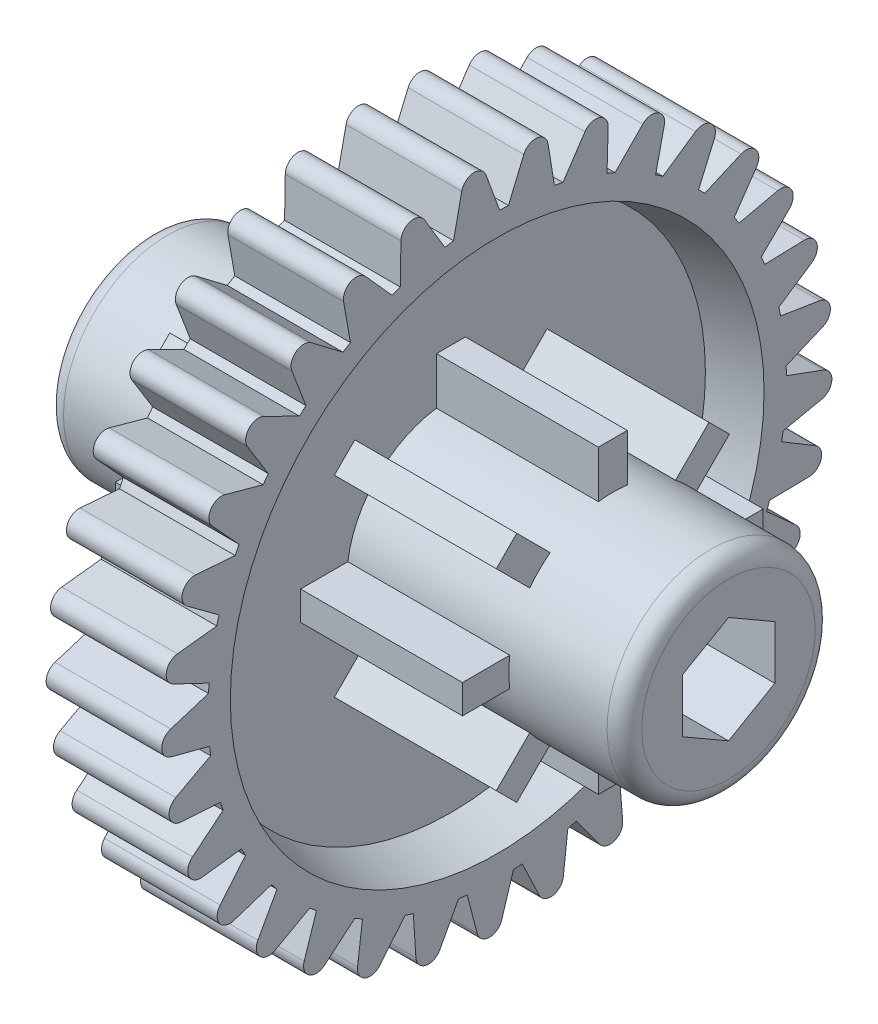
from build123d import *

# Parameters (mm, degrees)
SKETCH1_R           = 4.5
BOSS_EXTRUDE1_DEPTH = 12.5
BOSS_EXTRUDE2_DEPTH = 7.5
SKETCH3_R           = 11
BOSS_EXTRUDE3_DEPTH = 0.5
SKETCH5_R           = 12.5
SKETCH5_R_2         = 11
BOSS_EXTRUDE4_DEPTH = 2.5
DRAFT4_ANGLE        = 15
BOSS_EXTRUDE5_DEPTH = 2.5
FILLET1_R           = 0.75
CUT_EXTRUDE1_DEPTH  = 25.013233318


with BuildPart() as part:
    # Sketch1 → Boss-Extrude1 (new body)
    with BuildSketch(Plane(origin=(0, 0, 0), x_dir=(0, 0, -1), z_dir=(1, 0, 0))):
        Circle(SKETCH1_R)
        Polygon((0, -2.309401077), (2, -1.154700538), (2, 1.154700538), (0, 2.309401077), (-2, 1.154700538), (-2, -1.154700538), align=None, mode=Mode.SUBTRACT)
    extrude(amount=BOSS_EXTRUDE1_DEPTH)

    # Sketch2 → Boss-Extrude2 (add)
    with BuildSketch(Plane(origin=(0, 0, 0), x_dir=(0, 0, -1), z_dir=(1, 0, 0))):
        with BuildLine():
            Line((-0.625, 4.456385867), (-0.625, 6.5))
            Line((-0.625, 6.5), (0.625, 6.5))
            Line((0.625, 6.5), (0.625, 4.456385867))
            ThreePointArc((0.625, 4.456385867), (0, 4.5), (-0.625, 4.456385867))
        make_face()
        with BuildLine():
            Line((2.709198928, 3.593082405), (4.154252339, 5.038135816))
            Line((4.154252339, 5.038135816), (5.038135816, 4.154252339))
            Line((5.038135816, 4.154252339), (3.593082405, 2.709198928))
            ThreePointArc((3.593082405, 2.709198928), (3.181980515, 3.181980515), (2.709198928, 3.593082405))
        make_face()
        with BuildLine():
            Line((4.456385867, 0.625), (6.5, 0.625))
            Line((6.5, 0.625), (6.5, -0.625))
            Line((6.5, -0.625), (4.456385867, -0.625))
            ThreePointArc((4.456385867, -0.625), (4.5, 0), (4.456385867, 0.625))
        make_face()
        with BuildLine():
            Line((3.593082405, -2.709198928), (5.038135816, -4.154252339))
            Line((5.038135816, -4.154252339), (4.154252339, -5.038135816))
            Line((4.154252339, -5.038135816), (2.709198928, -3.593082405))
            ThreePointArc((2.709198928, -3.593082405), (3.181980515, -3.181980515), (3.593082405, -2.709198928))
        make_face()
        with BuildLine():
            Line((0.625, -4.456385867), (0.625, -6.5))
            Line((0.625, -6.5), (-0.625, -6.5))
            Line((-0.625, -6.5), (-0.625, -4.456385867))
            ThreePointArc((-0.625, -4.456385867), (0, -4.5), (0.625, -4.456385867))
        make_face()
        with BuildLine():
            Line((-2.709198928, -3.593082405), (-4.154252339, -5.038135816))
            Line((-4.154252339, -5.038135816), (-5.038135816, -4.154252339))
            Line((-5.038135816, -4.154252339), (-3.593082405, -2.709198928))
            ThreePointArc((-3.593082405, -2.709198928), (-3.181980515, -3.181980515), (-2.709198928, -3.593082405))
        make_face()
        with BuildLine():
            Line((-4.456385867, -0.625), (-6.5, -0.625))
            Line((-6.5, -0.625), (-6.5, 0.625))
            Line((-6.5, 0.625), (-4.456385867, 0.625))
            ThreePointArc((-4.456385867, 0.625), (-4.5, 0), (-4.456385867, -0.625))
        make_face()
        with BuildLine():
            Line((-3.593082405, 2.709198928), (-5.038135816, 4.154252339))
            Line((-5.038135816, 4.154252339), (-4.154252339, 5.038135816))
            Line((-4.154252339, 5.038135816), (-2.709198928, 3.593082405))
            ThreePointArc((-2.709198928, 3.593082405), (-3.181980515, 3.181980515), (-3.593082405, 2.709198928))
        make_face()
    extrude(amount=BOSS_EXTRUDE2_DEPTH)

    # Sketch3 → Boss-Extrude3 (add)
    with BuildSketch(Plane(origin=(0, 0, 0), x_dir=(0, 0, -1), z_dir=(1, 0, 0))):
        Circle(SKETCH3_R)
    extrude(amount=BOSS_EXTRUDE3_DEPTH)

    # Sketch5 → Boss-Extrude4 (add)
    with BuildSketch(Plane(origin=(0, 0, 0), x_dir=(0, 0, -1), z_dir=(1, 0, 0))):
        Circle(SKETCH5_R)
        Circle(SKETCH5_R_2, mode=Mode.SUBTRACT)
    extrude(amount=BOSS_EXTRUDE4_DEPTH)

    # Draft4
    draft4_faces = [part.faces().sort_by_distance(p)[0] for p in [
        (1.5, 0, 11),
    ]]
    draft(draft4_faces, Plane(origin=(0.5, 0, 0), x_dir=(0, 0, 1), z_dir=(1, 0, 0)), DRAFT4_ANGLE)

    # Sketch6 → Boss-Extrude5 (add)
    with BuildSketch(Plane(origin=(0, 0, 0), x_dir=(0, 0, -1), z_dir=(1, 0, 0))):
        with BuildLine():
            Line((-9.758179239, -7.812038015), (-11.38352881, -8.342998719))
            ThreePointArc((-11.38352881, -8.342998719), (-12.0098, -8.128467143), (-11.976202747, -7.467323721))
            Line((-11.976202747, -7.467323721), (-10.879194443, -6.155739457))
            ThreePointArc((-10.879194443, -6.155739457), (-10.351865984, -7.006345028), (-9.758179239, -7.812038015))
        make_face()
        with BuildLine():
            Line((-8.103398312, -9.517611875), (-9.598890726, -10.346576856))
            ThreePointArc((-9.598890726, -10.346576856), (-10.254444746, -10.254444746), (-10.346576856, -9.598890726))
            Line((-10.346576856, -9.598890726), (-9.517611875, -8.103398312))
            ThreePointArc((-9.517611875, -8.103398312), (-8.838834765, -8.838834765), (-8.103398312, -9.517611875))
        make_face()
        with BuildLine():
            Line((-11.060274143, -5.824116747), (-12.756736504, -6.037882871))
            ThreePointArc((-12.756736504, -6.037882871), (-13.331089789, -5.708705558), (-13.172977468, -5.06586818))
            Line((-13.172977468, -5.06586818), (-11.847574579, -3.98559614))
            ThreePointArc((-11.847574579, -3.98559614), (-11.490753795, -4.920627727), (-11.060274143, -5.824116747))
        make_face()
        with BuildLine():
            Line((-11.962621922, -3.625696726), (-13.668882503, -3.514542204))
            ThreePointArc((-13.668882503, -3.514542204), (-14.17055926, -3.08261648), (-13.893646461, -2.481318965))
            Line((-13.893646461, -2.481318965), (-12.387752501, -1.671402994))
            ThreePointArc((-12.387752501, -1.671402994), (-12.214335825, -2.657066119), (-11.962621922, -3.625696726))
        make_face()
        with BuildLine():
            Line((-12.432609377, -1.296234578), (-14.086999475, -0.864176825))
            ThreePointArc((-14.086999475, -0.864176825), (-14.497867799, -0.345113611), (-14.112162872, 0.192911583))
            Line((-14.112162872, 0.192911583), (-12.480204772, 0.703199011))
            ThreePointArc((-12.480204772, 0.703199011), (-12.496459934, -0.297471219), (-12.432609377, -1.296234578))
        make_face()
        with BuildLine():
            Line((-12.453249936, 1.080076865), (-13.995975582, 1.817422156))
            ThreePointArc((-13.995975582, 1.817422156), (-14.301185621, 2.404862563), (-13.820628947, 2.860169803))
            Line((-13.820628947, 2.860169803), (-12.121589925, 3.052385572))
            ThreePointArc((-12.121589925, 3.052385572), (-12.326929421, 2.072875066), (-12.453249936, 1.080076865))
        make_face()
        with BuildLine():
            Line((-12.023797596, 3.417351515), (-13.399100666, 4.433334765))
            ThreePointArc((-13.399100666, 4.433334765), (-13.587621334, 5.067920738), (-13.029581483, 5.424054035))
            Line((-13.029581483, 5.424054035), (-11.324869236, 5.291250965))
            ThreePointArc((-11.324869236, 5.291250965), (-11.711871562, 4.368302245), (-12.023797596, 3.417351515))
        make_face()
        with BuildLine():
            Line((-11.159773883, 5.631114178), (-12.31794734, 6.889015105))
            ThreePointArc((-12.31794734, 6.889015105), (-12.382965009, 7.547811054), (-11.767610996, 7.791898821))
            Line((-11.767610996, 7.791898821), (-10.118838267, 7.338876762))
            ThreePointArc((-10.118838267, 7.338876762), (-10.67351615, 6.5058476), (-11.159773883, 5.631114178))
        make_face()
        with BuildLine():
            Line((-9.892406865, 7.641353703), (-10.791591304, 9.095708489))
            ThreePointArc((-10.791591304, 9.095708489), (-10.730756065, 9.754903812), (-10.080328387, 9.878124083))
            Line((-10.080328387, 9.878124083), (-8.547086117, 9.121256432))
            ThreePointArc((-8.547086117, 9.121256432), (-9.249392055, 8.408254671), (-9.892406865, 7.641353703))
        make_face()
        with BuildLine():
            Line((-8.267502489, 9.375414796), (-8.875199041, 10.97365927))
            ThreePointArc((-8.875199041, 10.97365927), (-8.690709639, 11.60942893), (-8.028716447, 11.607328203))
            Line((-8.028716447, 11.607328203), (-6.666420007, 10.573970129))
            ThreePointArc((-6.666420007, 10.573970129), (-7.490970831, 10.006765512), (-8.267502489, 9.375414796))
        make_face()
        with BuildLine():
            Line((-6.343789032, 10.770623971), (-6.63803396, 12.454993414))
            ThreePointArc((-6.63803396, 12.454993414), (-6.336558323, 13.044359039), (-5.686925775, 12.917013239))
            Line((-5.686925775, 12.917013239), (-4.544812108, 11.644512996))
            ThreePointArc((-4.544812108, 11.644512996), (-5.461806405, 11.243605774), (-6.343789032, 10.770623971))
        make_face()
        with BuildLine():
            Line((-4.190794511, 11.776554733), (-4.160953036, 13.486171644))
            ThreePointArc((-4.160953036, 13.486171644), (-3.753387279, 14.007832025), (-3.139594789, 13.759843762))
            Line((-3.139594789, 13.759843762), (-2.258942858, 12.294192823))
            ThreePointArc((-2.258942858, 12.294192823), (-3.235238064, 12.074072829), (-4.190794511, 11.776554733))
        make_face()
        with BuildLine():
            Line((-1.886333757, 12.356850123), (-1.533484429, 14.029924494))
            ThreePointArc((-1.533484429, 14.029924494), (-1.03455904, 14.465025465), (-0.478790667, 14.10535768))
            Line((-0.478790667, 14.10535768), (0.108570472, 12.499528489))
            ThreePointArc((0.108570472, 12.499528489), (-0.89173979, 12.468151433), (-1.886333757, 12.356850123))
        make_face()
        with BuildLine():
            Line((0.486304014, 12.490536754), (1.149408301, 14.066599317))
            ThreePointArc((1.149408301, 14.066599317), (1.721660859, 14.399415197), (2.199318198, 13.941067221))
            Line((2.199318198, 13.941067221), (2.472159783, 12.253098629))
            ThreePointArc((2.472159783, 12.253098629), (1.483988283, 12.411598558), (0.486304014, 12.490536754))
        make_face()
        with BuildLine():
            Line((2.84136549, 12.172782843), (3.79075842, 13.594870591))
            ThreePointArc((3.79075842, 13.594870591), (4.415655449, 13.813372545), (4.797937972, 13.272910269))
            Line((4.797937972, 13.272910269), (4.746398798, 11.563809859))
            ThreePointArc((4.746398798, 11.563809859), (3.806081153, 11.906458174), (2.84136549, 12.172782843))
        make_face()
        with BuildLine():
            Line((5.093732614, 11.415072845), (6.295100654, 12.631787821))
            ThreePointArc((6.295100654, 12.631787821), (6.950056745, 12.72807862), (7.223147767, 12.125035758))
            Line((7.223147767, 12.125035758), (6.849090594, 10.456574871))
            ThreePointArc((6.849090594, 10.456574871), (5.990612334, 10.97098737), (5.093732614, 11.415072845))
        make_face()
        with BuildLine():
            Line((7.161998971, 10.244792372), (8.571921548, 11.212159327))
            ThreePointArc((8.571921548, 11.212159327), (9.233264883, 11.182758771), (9.387294182, 10.538930863))
            Line((9.387294182, 10.538930863), (8.70423841, 8.971412024))
            ThreePointArc((8.70423841, 8.971412024), (7.958627176, 9.638996497), (7.161998971, 10.244792372))
        make_face()
        with BuildLine():
            Line((8.971412024, 8.70423841), (10.538930863, 9.387294182))
            ThreePointArc((10.538930863, 9.387294182), (11.182758771, 9.233264883), (11.212159327, 8.571921548))
            Line((11.212159327, 8.571921548), (10.244792372, 7.161998971))
            ThreePointArc((10.244792372, 7.161998971), (9.638996497, 7.958627176), (8.971412024, 8.70423841))
        make_face()
        with BuildLine():
            Line((10.456574871, 6.849090594), (12.125035758, 7.223147767))
            ThreePointArc((12.125035758, 7.223147767), (12.72807862, 6.950056745), (12.631787821, 6.295100654))
            Line((12.631787821, 6.295100654), (11.415072845, 5.093732614))
            ThreePointArc((11.415072845, 5.093732614), (10.97098737, 5.990612334), (10.456574871, 6.849090594))
        make_face()
        with BuildLine():
            Line((11.563809859, 4.746398798), (13.272910269, 4.797937972))
            ThreePointArc((13.272910269, 4.797937972), (13.813372545, 4.415655449), (13.594870591, 3.79075842))
            Line((13.594870591, 3.79075842), (12.172782843, 2.84136549))
            ThreePointArc((12.172782843, 2.84136549), (11.906458174, 3.806081153), (11.563809859, 4.746398798))
        make_face()
        with BuildLine():
            Line((12.253098629, 2.472159783), (13.941067221, 2.199318198))
            ThreePointArc((13.941067221, 2.199318198), (14.399415197, 1.721660859), (14.066599317, 1.149408301))
            Line((14.066599317, 1.149408301), (12.490536754, 0.486304014))
            ThreePointArc((12.490536754, 0.486304014), (12.411598558, 1.483988283), (12.253098629, 2.472159783))
        make_face()
        with BuildLine():
            Line((12.499528489, 0.108570472), (14.10535768, -0.478790667))
            ThreePointArc((14.10535768, -0.478790667), (14.465025465, -1.03455904), (14.029924494, -1.533484429))
            Line((14.029924494, -1.533484429), (12.356850123, -1.886333757))
            ThreePointArc((12.356850123, -1.886333757), (12.468151433, -0.89173979), (12.499528489, 0.108570472))
        make_face()
        with BuildLine():
            Line((12.294192823, -2.258942858), (13.759843762, -3.139594789))
            ThreePointArc((13.759843762, -3.139594789), (14.007832025, -3.753387279), (13.486171644, -4.160953036))
            Line((13.486171644, -4.160953036), (11.776554733, -4.190794511))
            ThreePointArc((11.776554733, -4.190794511), (12.074072829, -3.235238064), (12.294192823, -2.258942858))
        make_face()
        with BuildLine():
            Line((11.644512996, -4.544812108), (12.917013239, -5.686925775))
            ThreePointArc((12.917013239, -5.686925775), (13.044359039, -6.336558323), (12.454993414, -6.63803396))
            Line((12.454993414, -6.63803396), (10.770623971, -6.343789032))
            ThreePointArc((10.770623971, -6.343789032), (11.243605774, -5.461806405), (11.644512996, -4.544812108))
        make_face()
        with BuildLine():
            Line((10.573970129, -6.666420007), (11.607328203, -8.028716447))
            ThreePointArc((11.607328203, -8.028716447), (11.60942893, -8.690709639), (10.97365927, -8.875199041))
            Line((10.97365927, -8.875199041), (9.375414796, -8.267502489))
            ThreePointArc((9.375414796, -8.267502489), (10.006765512, -7.490970831), (10.573970129, -6.666420007))
        make_face()
        with BuildLine():
            Line((9.121256432, -8.547086117), (9.878124083, -10.080328387))
            ThreePointArc((9.878124083, -10.080328387), (9.754903812, -10.730756065), (9.095708489, -10.791591304))
            Line((9.095708489, -10.791591304), (7.641353703, -9.892406865))
            ThreePointArc((7.641353703, -9.892406865), (8.408254671, -9.249392055), (9.121256432, -8.547086117))
        make_face()
        with BuildLine():
            Line((7.338876762, -10.118838267), (7.791898821, -11.767610996))
            ThreePointArc((7.791898821, -11.767610996), (7.547811054, -12.382965009), (6.889015105, -12.31794734))
            Line((6.889015105, -12.31794734), (5.631114178, -11.159773883))
            ThreePointArc((5.631114178, -11.159773883), (6.5058476, -10.67351615), (7.338876762, -10.118838267))
        make_face()
        with BuildLine():
            Line((5.291250965, -11.324869236), (5.424054035, -13.029581483))
            ThreePointArc((5.424054035, -13.029581483), (5.067920738, -13.587621334), (4.433334765, -13.399100666))
            Line((4.433334765, -13.399100666), (3.417351515, -12.023797596))
            ThreePointArc((3.417351515, -12.023797596), (4.368302245, -11.711871562), (5.291250965, -11.324869236))
        make_face()
        with BuildLine():
            Line((3.052385572, -12.121589925), (2.860169803, -13.820628947))
            ThreePointArc((2.860169803, -13.820628947), (2.404862563, -14.301185621), (1.817422156, -13.995975582))
            Line((1.817422156, -13.995975582), (1.080076865, -12.453249936))
            ThreePointArc((1.080076865, -12.453249936), (2.072875066, -12.326929421), (3.052385572, -12.121589925))
        make_face()
        with BuildLine():
            Line((0.703199011, -12.480204772), (0.192911583, -14.112162872))
            ThreePointArc((0.192911583, -14.112162872), (-0.345113611, -14.497867799), (-0.864176825, -14.086999475))
            Line((-0.864176825, -14.086999475), (-1.296234578, -12.432609377))
            ThreePointArc((-1.296234578, -12.432609377), (-0.297471219, -12.496459934), (0.703199011, -12.480204772))
        make_face()
        with BuildLine():
            Line((-1.671402994, -12.387752501), (-2.481318965, -13.893646461))
            ThreePointArc((-2.481318965, -13.893646461), (-3.08261648, -14.17055926), (-3.514542204, -13.668882503))
            Line((-3.514542204, -13.668882503), (-3.625696726, -11.962621922))
            ThreePointArc((-3.625696726, -11.962621922), (-2.657066119, -12.214335825), (-1.671402994, -12.387752501))
        make_face()
        with BuildLine():
            Line((-3.98559614, -11.847574579), (-5.06586818, -13.172977468))
            ThreePointArc((-5.06586818, -13.172977468), (-5.708705558, -13.331089789), (-6.037882871, -12.756736504))
            Line((-6.037882871, -12.756736504), (-5.824116747, -11.060274143))
            ThreePointArc((-5.824116747, -11.060274143), (-4.920627727, -11.490753795), (-3.98559614, -11.847574579))
        make_face()
        with BuildLine():
            Line((-6.155739457, -10.879194443), (-7.467323721, -11.976202747))
            ThreePointArc((-7.467323721, -11.976202747), (-8.128467143, -12.0098), (-8.342998719, -11.38352881))
            Line((-8.342998719, -11.38352881), (-7.812038015, -9.758179239))
            ThreePointArc((-7.812038015, -9.758179239), (-7.006345028, -10.351865984), (-6.155739457, -10.879194443))
        make_face()
    extrude(amount=BOSS_EXTRUDE5_DEPTH)

    # Fillet1
    fillet1_edges = [part.edges().sort_by_distance(p)[0] for p in [
        (12.5, 0, 4.5),
    ]]
    fillet(fillet1_edges, radius=FILLET1_R)

    # Sketch7 → Cut-Extrude1 (cut, through all)
    with BuildSketch(Plane(origin=(12.5, 0, 0), x_dir=(0, 0, -1), z_dir=(1, 0, 0))):
        Polygon((2, 1.154700538), (0, 2.309401077), (-2, 1.154700538), (-2, -1.154700538), (0, -2.309401077), (2, -1.154700538), align=None)
    extrude(amount=-CUT_EXTRUDE1_DEPTH, mode=Mode.SUBTRACT)

    # Mirror1: part across plane


with BuildPart() as part_1:
    add(part.part)
    add(part.part.mirror(Plane(origin=(0, 0, 0), x_dir=(0, 0, 1), z_dir=(1, 0, 0))))


solid = part_1.part
